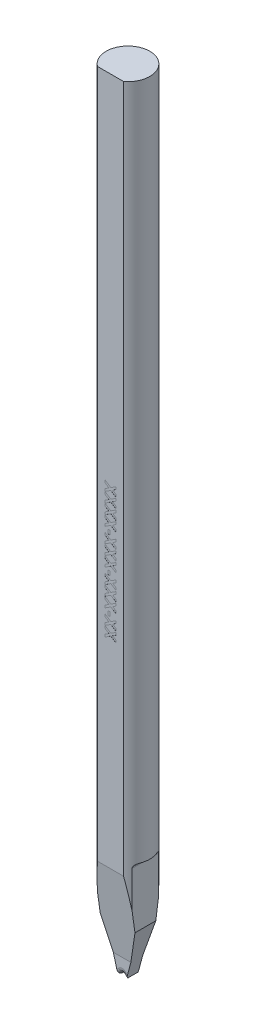
from build123d import *

# Parameters (mm, degrees)
SKETCH_TL_CUTTING_R       = 1.99771
TL_CUTTING_DEPTH          = 72.009
SKETCH_TDF_GRINDING_W     = 4.01542
SKETCH_TDF_GRINDING_H     = 4.01542
TDF_GRINDING_DEPTH        = 73.064400167
SKETCH_ENGRAVING_W        = 0.166666667
SKETCH_ENGRAVING_H        = 0.371794872
ENGRAVING_DEPTH           = 0.005
VW_VR_GRINDING_DEPTH      = 2.00771
VW_VR_GRINDING_DEPTH_BACK = 2.00771
ISA_GRINDING_DEPTH        = 2.00771
ISA_GRINDING_DEPTH_BACK   = 2.00771
PRE_FRX_BRX_DEPTH         = 2.00771
PRE_FRX_BRX_DEPTH_BACK    = 2.00771
SKETCH_PRE_FRX_BRX_W      = 1.46796
SKETCH_PRE_FRX_BRX_H      = 1.4986
FR_EDM_R                  = 0.39878
BR_EDM_R                  = 0.20066
FA_BA_GRINDING_DEPTH      = 2.00771
FA_BA_GRINDING_DEPTH_BACK = 2.00771


with BuildPart() as part:
    # sketch_TL_cutting → TL_cutting (new body)
    with BuildSketch(Plane(origin=(0, 0, 0), x_dir=(1, 0, 0), z_dir=(0, 1, 0))):
        Circle(SKETCH_TL_CUTTING_R)
    extrude(amount=TL_CUTTING_DEPTH)

    # sketch_TDF_grinding → TDF_grinding (cut, through all)
    with BuildSketch(Plane(origin=(0, 0, 0), x_dir=(1, 0, 0), z_dir=(0, 1, 0))):
        with Locations((0, -3.60918)):
            Rectangle(SKETCH_TDF_GRINDING_W, SKETCH_TDF_GRINDING_H)
    extrude(amount=TDF_GRINDING_DEPTH, mode=Mode.SUBTRACT)

    # sketch_engraving → engraving (cut)
    with BuildSketch(Plane.XY.offset(1.60147)):
        Polygon((-0.5, 39.598539744), (0.029647436, 39.255791346), (0.5, 39.560078205), (0.5, 39.33531859), (0.203325321, 39.143411538), (0.5, 38.951504487), (0.5, 38.726744872), (0.029647436, 39.031031731), (-0.5, 38.688283333), (-0.5, 38.913042949), (-0.144030449, 39.143411538), (-0.5, 39.373780128), align=None)
        Polygon((-0.5, 38.675462821), (0.029647436, 38.332714423), (0.5, 38.637001282), (0.5, 38.412241667), (0.203325321, 38.220334615), (0.5, 38.028427564), (0.5, 37.803667949), (0.029647436, 38.107954808), (-0.5, 37.76520641), (-0.5, 37.989966026), (-0.144030449, 38.220334615), (-0.5, 38.450703205), align=None)
        Polygon((-0.5, 37.752385897), (0.029647436, 37.4096375), (0.5, 37.713924359), (0.5, 37.489164744), (0.203325321, 37.297257692), (0.5, 37.105350641), (0.5, 36.880591026), (0.029647436, 37.184877885), (-0.5, 36.842129487), (-0.5, 37.066889103), (-0.144030449, 37.297257692), (-0.5, 37.527626282), align=None)
        Polygon((-0.5, 36.829308974), (0.029647436, 36.486560577), (0.5, 36.790847436), (0.5, 36.566087821), (0.203325321, 36.374180769), (0.5, 36.182273718), (0.5, 35.957514103), (0.029647436, 36.261800962), (-0.5, 35.919052564), (-0.5, 36.143812179), (-0.144030449, 36.374180769), (-0.5, 36.604549359), align=None)
        with Locations((-0.147435898, 35.649821795)):
            Rectangle(SKETCH_ENGRAVING_W, SKETCH_ENGRAVING_H)
        Polygon((-0.5, 35.44469359), (0.029647436, 35.101945192), (0.5, 35.406232051), (0.5, 35.181472436), (0.203325321, 34.989565385), (0.5, 34.797658333), (0.5, 34.572898718), (0.029647436, 34.877185577), (-0.5, 34.534437179), (-0.5, 34.759196795), (-0.144030449, 34.989565385), (-0.5, 35.219933974), align=None)
        Polygon((-0.5, 34.521616667), (0.029647436, 34.178868269), (0.5, 34.483155128), (0.5, 34.258395513), (0.203325321, 34.066488462), (0.5, 33.87458141), (0.5, 33.649821795), (0.029647436, 33.954108654), (-0.5, 33.611360256), (-0.5, 33.836119872), (-0.144030449, 34.066488462), (-0.5, 34.296857051), align=None)
        Polygon((-0.5, 33.598539744), (0.029647436, 33.255791346), (0.5, 33.560078205), (0.5, 33.33531859), (0.203325321, 33.143411538), (0.5, 32.951504487), (0.5, 32.726744872), (0.029647436, 33.031031731), (-0.5, 32.688283333), (-0.5, 32.913042949), (-0.144030449, 33.143411538), (-0.5, 33.373780128), align=None)
        with Locations((-0.147435898, 32.419052564)):
            Rectangle(SKETCH_ENGRAVING_W, SKETCH_ENGRAVING_H)
        Polygon((-0.5, 32.213924359), (0.029647436, 31.871175962), (0.5, 32.175462821), (0.5, 31.950703205), (0.203325321, 31.758796154), (0.5, 31.566889103), (0.5, 31.342129487), (0.029647436, 31.646416346), (-0.5, 31.303667949), (-0.5, 31.528427564), (-0.144030449, 31.758796154), (-0.5, 31.989164744), align=None)
        Polygon((-0.5, 31.290847436), (0.029647436, 30.948099038), (0.5, 31.252385897), (0.5, 31.027626282), (0.203325321, 30.835719231), (0.5, 30.643812179), (0.5, 30.419052564), (0.029647436, 30.723339423), (-0.5, 30.380591026), (-0.5, 30.605350641), (-0.144030449, 30.835719231), (-0.5, 31.066087821), align=None)
        Polygon((-0.5, 30.367770513), (0.029647436, 30.025022115), (0.5, 30.329308974), (0.5, 30.104549359), (0.203325321, 29.912642308), (0.5, 29.720735256), (0.5, 29.495975641), (0.029647436, 29.8002625), (-0.5, 29.457514103), (-0.5, 29.682273718), (-0.144030449, 29.912642308), (-0.5, 30.143010897), align=None)
        with Locations((-0.147435898, 29.188283333)):
            Rectangle(SKETCH_ENGRAVING_W, SKETCH_ENGRAVING_H)
        Polygon((-0.5, 28.983155128), (0.029647436, 28.640406731), (0.5, 28.94469359), (0.5, 28.719933974), (0.203325321, 28.528026923), (0.5, 28.336119872), (0.5, 28.111360256), (0.029647436, 28.415647115), (-0.5, 28.072898718), (-0.5, 28.297658333), (-0.144030449, 28.528026923), (-0.5, 28.758395513), align=None)
        Polygon((-0.5, 28.060078205), (0.029647436, 27.717329808), (0.5, 28.021616667), (0.5, 27.796857051), (0.203325321, 27.60495), (0.5, 27.413042949), (0.5, 27.188283333), (0.029647436, 27.492570192), (-0.5, 27.149821795), (-0.5, 27.37458141), (-0.144030449, 27.60495), (-0.5, 27.83531859), align=None)
    extrude(amount=-ENGRAVING_DEPTH, mode=Mode.SUBTRACT)

    # sketch_VW_VR_grinding → VW_VR_grinding (cut, two sides: drawn at the far end of the back side and taken through both)
    with BuildSketch(Plane.XY.offset(-VW_VR_GRINDING_DEPTH_BACK)):
        with BuildLine():
            Line((-1.59004, -0.01), (-1.59004, 9.681972))
            ThreePointArc((-1.59004, 9.681972), (-1.683182387, 9.906837613), (-1.908048, 9.99998))
            Line((-1.908048, 9.99998), (-2.00771, 9.99998))
            Line((-2.00771, 9.99998), (-2.00771, -0.01))
            Line((-2.00771, -0.01), (-1.59004, -0.01))
        make_face()
        with BuildLine():
            Line((1.59004, -0.01), (1.59004, 9.681972))
            ThreePointArc((1.59004, 9.681972), (1.683182387, 9.906837613), (1.908048, 9.99998))
            Line((1.908048, 9.99998), (2.00771, 9.99998))
            Line((2.00771, 9.99998), (2.00771, -0.01))
            Line((2.00771, -0.01), (1.59004, -0.01))
        make_face()
    extrude(amount=VW_VR_GRINDING_DEPTH + VW_VR_GRINDING_DEPTH_BACK, mode=Mode.SUBTRACT)

    # sketch_ISA_grinding → ISA_grinding (cut, two sides: drawn at the far end of the back side and taken through both)
    with BuildSketch(Plane.XY.offset(-ISA_GRINDING_DEPTH_BACK)):
        Polygon((-0.40005, 0), (-2.00771, 5.999868801), (-2.00771, -0.01), (2.00771, -0.01), (2.00771, 5.999868801), (0.40005, 0), align=None)
    extrude(amount=ISA_GRINDING_DEPTH + ISA_GRINDING_DEPTH_BACK, mode=Mode.SUBTRACT)

    # sketch_pre_FRX_BRX → pre_FRX_BRX (cut, two sides: drawn at the far end of the back side and taken through both)
    with BuildSketch(Plane(origin=(0, 0, 0), x_dir=(0, 0, -1), z_dir=(1, 0, 0)).offset(-PRE_FRX_BRX_DEPTH_BACK)):
        with Locations((-1.27373, 0.7393)):
            Rectangle(SKETCH_PRE_FRX_BRX_W, SKETCH_PRE_FRX_BRX_H)
        with Locations((1.27373, 0.7393)):
            Rectangle(SKETCH_PRE_FRX_BRX_W, SKETCH_PRE_FRX_BRX_H)
    extrude(amount=PRE_FRX_BRX_DEPTH + PRE_FRX_BRX_DEPTH_BACK, mode=Mode.SUBTRACT)

    # V-Groove_EDM: sweep along a path in sketch_contour_V-Groove
    with BuildLine(Plane(origin=(0, 0, 0), x_dir=(0, 0, -1), z_dir=(1, 0, 0))) as v_groove_edm_path:
        Line((-1.60147, 0.2286), (0, 0.2286))
        Line((0, 0.2286), (1.99771, 0.2286))
    # sketch_section_V-Groove → V-Groove_EDM (sweep, cut)
    with BuildSketch(Plane.XY.offset(1.60147)):
        with BuildLine():
            Line((-2.53111, -2.286), (-0.028184333, 0.216925667))
            ThreePointArc((-0.028184333, 0.216925667), (0, 0.2286), (0.028184333, 0.216925667))
            Line((0.028184333, 0.216925667), (2.53111, -2.286))
            Line((2.53111, -2.286), (-2.53111, -2.286))
        make_face()
    sweep(path=v_groove_edm_path.line, mode=Mode.SUBTRACT)

    # FR_EDM
    fr_edm_edges = [part.edges().sort_by_distance(p)[0] for p in [
        (0.136647166, 0.108462834, 0.53975),
        (0, 0.2286, 0.53975),
        (-0.136647166, 0.108462834, 0.53975),
    ]]
    fillet(fr_edm_edges, radius=FR_EDM_R)

    # BR_EDM
    br_edm_edges = [part.edges().sort_by_distance(p)[0] for p in [
        (0.136647166, 0.108462834, -0.53975),
        (0, 0.2286, -0.53975),
        (-0.136647166, 0.108462834, -0.53975),
    ]]
    fillet(br_edm_edges, radius=BR_EDM_R)

    # sketch_FA_BA_grinding → FA_BA_grinding (cut, two sides: drawn at the far end of the back side and taken through both)
    with BuildSketch(Plane(origin=(0, 0, 0), x_dir=(0, 0, -1), z_dir=(1, 0, 0)).offset(-FA_BA_GRINDING_DEPTH_BACK)):
        Polygon((2.99771, 18.987894163), (2.99771, -0.1), (0.53975, -0.1), (0.53975, 1.4986), align=None)
        Polygon((-3.487458656, 22.472636919), (-0.53975, 1.4986), (-0.53975, -0.1), (-3.487458656, -0.1), align=None)
    extrude(amount=FA_BA_GRINDING_DEPTH + FA_BA_GRINDING_DEPTH_BACK, mode=Mode.SUBTRACT)


solid = part.part
